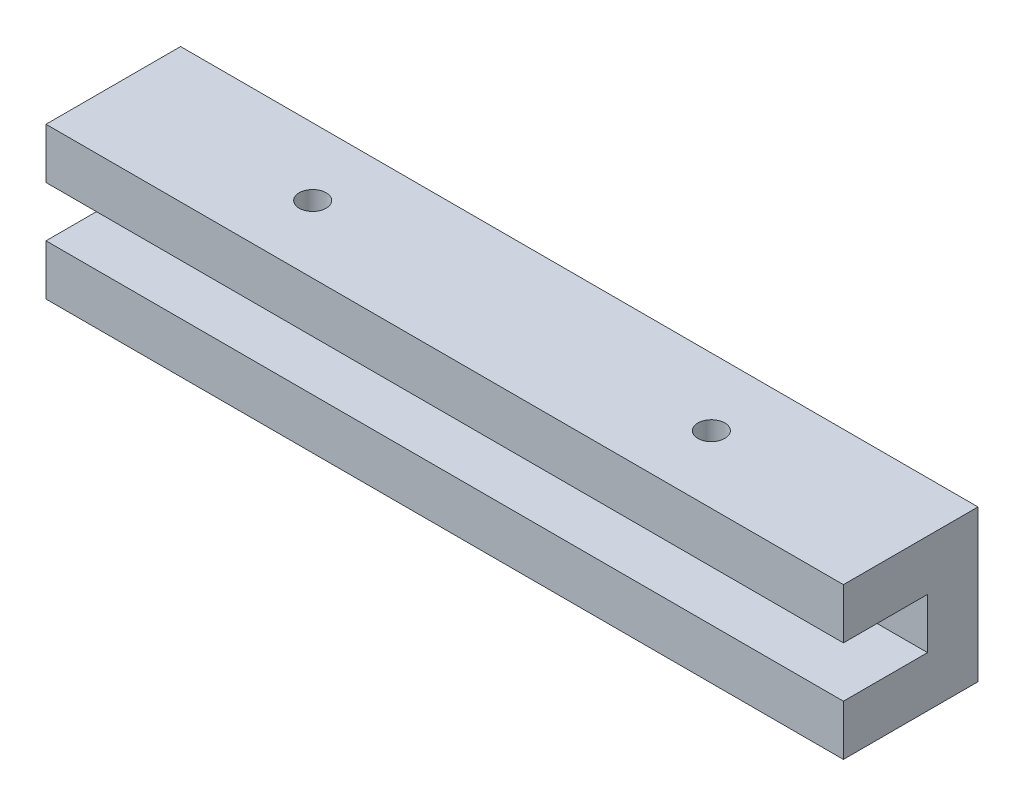
from build123d import *

# Parameters (mm, degrees)
SKETCH1_W               = 47.4
SKETCH1_H               = 8
BOSS_EXTRUDE1_DEPTH     = 9
CUT_EXTRUDE1_DEPTH      = 17
CUT_EXTRUDE1_DEPTH_BACK = 58
SKETCH2_W               = 5
SKETCH2_H               = 3
M2X0_4_TAPPED_HOLE1_D   = 1.6


with BuildPart() as part:
    # Sketch1 → Boss-Extrude1 (new body)
    with BuildSketch(Plane(origin=(0, 0, 0), x_dir=(1, 0, 0), z_dir=(0, 1, 0))):
        with Locations((9.069133192, 9.478435518)):
            Rectangle(SKETCH1_W, SKETCH1_H)
    extrude(amount=BOSS_EXTRUDE1_DEPTH)

    # Sketch2 → Cut-Extrude1 (cut, two sides: drawn at the far end of the back side and taken through both)
    with BuildSketch(Plane(origin=(32.769133192, 0, 0), x_dir=(0, 0, -1), z_dir=(1, 0, 0)).offset(-CUT_EXTRUDE1_DEPTH_BACK)):
        with Locations((7.978435518, 4.5)):
            Rectangle(SKETCH2_W, SKETCH2_H)
    extrude(amount=CUT_EXTRUDE1_DEPTH + CUT_EXTRUDE1_DEPTH_BACK, mode=Mode.SUBTRACT)

    # M2x0.4 Tapped Hole1 (through all)
    with Locations(Plane(origin=(0, 9, 0), x_dir=(1, 0, 0), z_dir=(0, 1, 0))):
        with Locations((-2.780866808, 9.478435518), (20.919133192, 9.478435518)):
            Hole(M2X0_4_TAPPED_HOLE1_D / 2)


solid = part.part
